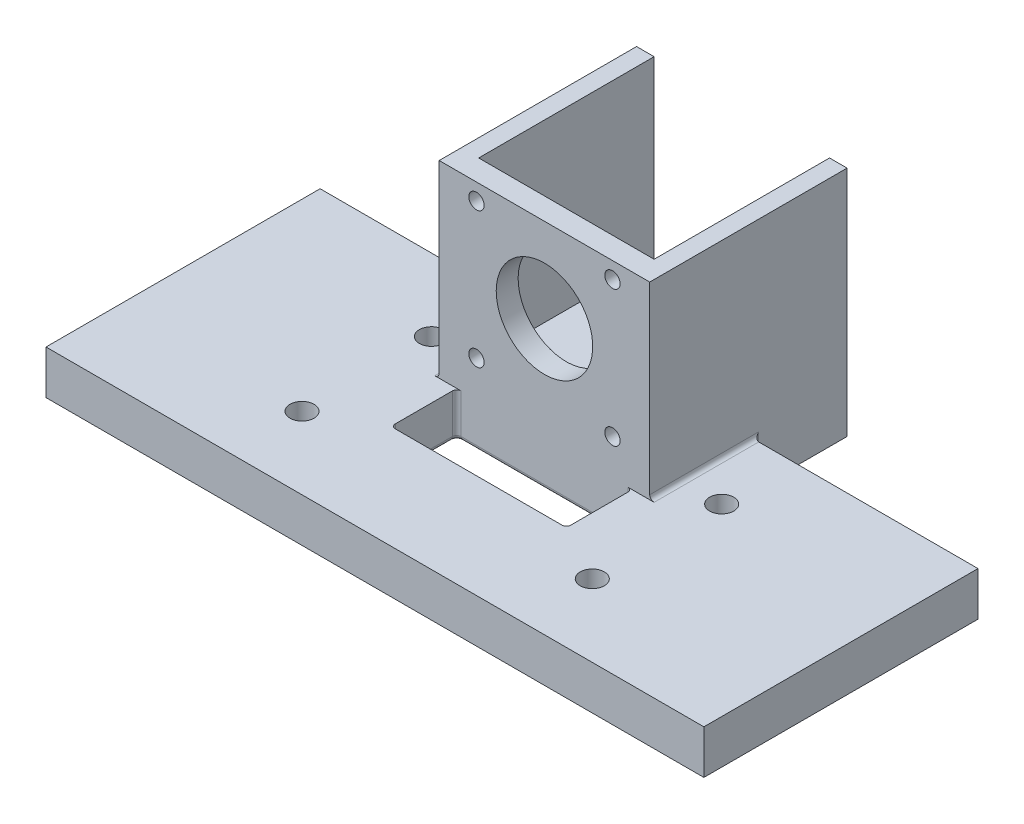
from build123d import *

# Parameters (mm, degrees)
SKETCH1_R            = 2.75
SKETCH1_W            = 40
SKETCH1_H            = 15
BOSS_EXTRUDE1_DEPTH  = 10
SKETCH3_W            = 40
SKETCH3_H            = 5
BOSS_EXTRUDE2_DEPTH  = 43
CUT_EXTRUDE1_REACH   = 166.968
SKETCH4_R            = 1.75
SKETCH4_R_2          = 11
SKETCH8_W            = 4
SKETCH8_H            = 45
BOSS_EXTRUDE4_DEPTH  = 43
SKETCH11_W           = 40
SKETCH11_H           = 40
BOSS_EXTRUDE15_DEPTH = 3
FILLET3_R            = 1
FILLET6_R            = 1
FILLET7_R            = 1


with BuildPart() as part:
    # Sketch1 → Boss-Extrude1 (new body)
    with BuildSketch(Plane(origin=(0, 0, 0), x_dir=(1, 0, 0), z_dir=(0, 1, 0))):
        Polygon((51, 62.5), (51, 83.65), (99, 83.65), (99, 62.5), (150, 62.5), (150, 0), (0, 0), (0, 62.5), align=None)
        with Locations(Location((108.05464, 46, 0), (0, 0, 270))):
            Circle(SKETCH1_R, mode=Mode.SUBTRACT)
        with Locations(Location((41.87366, 46, 0), (0, 0, 270))):
            Circle(SKETCH1_R, mode=Mode.SUBTRACT)
        with Locations(Location((41.87366, 16.5, 0), (0, 0, 270))):
            Circle(SKETCH1_R, mode=Mode.SUBTRACT)
        with Locations(Location((108.05464, 16.5, 0), (0, 0, 270))):
            Circle(SKETCH1_R, mode=Mode.SUBTRACT)
        with Locations((75, 31.15)):
            Rectangle(SKETCH1_W, SKETCH1_H, mode=Mode.SUBTRACT)
    extrude(amount=BOSS_EXTRUDE1_DEPTH)

    # Sketch3 → Boss-Extrude2 (add)
    with BuildSketch(Plane(origin=(0, 10, 0), x_dir=(1, 0, 0), z_dir=(0, 1, 0))):
        with Locations((75, 41.15)):
            Rectangle(SKETCH3_W, SKETCH3_H)
    extrude(amount=BOSS_EXTRUDE2_DEPTH)

    # Sketch4 → Cut-Extrude1 (cut, up to next)
    with BuildSketch(Plane(origin=(0, 0, -43.65), x_dir=(-1, 0, 0), z_dir=(0, 0, -1)), mode=Mode.PRIVATE) as cut_extrude1_sk1:
        with Locations((-59.5, 18.25)):
            Circle(SKETCH4_R)
    cut_extrude1_tool1 = extrude(cut_extrude1_sk1.sketch, amount=-CUT_EXTRUDE1_REACH, mode=Mode.PRIVATE) & part.part
    # Sketch4 → Cut-Extrude1 (cut, up to next)
    with BuildSketch(Plane(origin=(0, 0, -43.65), x_dir=(-1, 0, 0), z_dir=(0, 0, -1)), mode=Mode.PRIVATE) as cut_extrude1_sk2:
        with Locations((-90.5, 18.25)):
            Circle(SKETCH4_R)
    cut_extrude1_tool2 = extrude(cut_extrude1_sk2.sketch, amount=-CUT_EXTRUDE1_REACH, mode=Mode.PRIVATE) & part.part
    # Sketch4 → Cut-Extrude1 (cut, up to next)
    with BuildSketch(Plane(origin=(0, 0, -43.65), x_dir=(-1, 0, 0), z_dir=(0, 0, -1)), mode=Mode.PRIVATE) as cut_extrude1_sk3:
        with Locations((-75, 33.75)):
            Circle(SKETCH4_R_2)
    cut_extrude1_tool3 = extrude(cut_extrude1_sk3.sketch, amount=-CUT_EXTRUDE1_REACH, mode=Mode.PRIVATE) & part.part
    # Sketch4 → Cut-Extrude1 (cut, up to next)
    with BuildSketch(Plane(origin=(0, 0, -43.65), x_dir=(-1, 0, 0), z_dir=(0, 0, -1)), mode=Mode.PRIVATE) as cut_extrude1_sk4:
        with Locations((-90.5, 49.25)):
            Circle(SKETCH4_R)
    cut_extrude1_tool4 = extrude(cut_extrude1_sk4.sketch, amount=-CUT_EXTRUDE1_REACH, mode=Mode.PRIVATE) & part.part
    # Sketch4 → Cut-Extrude1 (cut, up to next)
    with BuildSketch(Plane(origin=(0, 0, -43.65), x_dir=(-1, 0, 0), z_dir=(0, 0, -1)), mode=Mode.PRIVATE) as cut_extrude1_sk5:
        with Locations((-59.5, 49.25)):
            Circle(SKETCH4_R)
    cut_extrude1_tool5 = extrude(cut_extrude1_sk5.sketch, amount=-CUT_EXTRUDE1_REACH, mode=Mode.PRIVATE) & part.part
    add(cut_extrude1_tool1.solids().sort_by_distance((59.5, 18.25, -43.65))[0], mode=Mode.SUBTRACT)
    add(cut_extrude1_tool2.solids().sort_by_distance((90.5, 18.25, -43.65))[0], mode=Mode.SUBTRACT)
    add(cut_extrude1_tool3.solids().sort_by_distance((75, 33.75, -43.65))[0], mode=Mode.SUBTRACT)
    add(cut_extrude1_tool4.solids().sort_by_distance((90.5, 49.25, -43.65))[0], mode=Mode.SUBTRACT)
    add(cut_extrude1_tool5.solids().sort_by_distance((59.5, 49.25, -43.65))[0], mode=Mode.SUBTRACT)

    # Sketch8 → Boss-Extrude4 (add)
    with BuildSketch(Plane(origin=(0, 10, 0), x_dir=(1, 0, 0), z_dir=(0, 1, 0))):
        with Locations((53, 61.15)):
            Rectangle(SKETCH8_W, SKETCH8_H)
        with Locations((97, 61.15)):
            Rectangle(SKETCH8_W, SKETCH8_H)
    extrude(amount=BOSS_EXTRUDE4_DEPTH)

    # Sketch11 → Boss-Extrude15 (add)
    with BuildSketch(Plane(origin=(0, 10, 0), x_dir=(1, 0, 0), z_dir=(0, 1, 0))):
        with Locations((75, 63.65)):
            Rectangle(SKETCH11_W, SKETCH11_H)
    extrude(amount=BOSS_EXTRUDE15_DEPTH)

    # Fillet3
    fillet3_edges = [part.edges().sort_by_distance(p)[0] for p in [
        (55, 0, -31.15),
        (75, 0, -23.65),
        (95, 0, -31.15),
        (75, 0, -38.65),
        (55, 5, -38.65),
        (55, 5, -23.65),
        (95, 5, -23.65),
        (95, 5, -38.65),
    ]]
    fillet(fillet3_edges, radius=FILLET3_R)

    # Fillet6
    fillet6_edges = [part.edges().sort_by_distance(p)[0] for p in [
        (99, 10, -50.575),
        (51, 10, -50.575),
    ]]
    fillet(fillet6_edges, radius=FILLET6_R)

    # Fillet7
    fillet7_edges = [part.edges().sort_by_distance(p)[0] for p in [
        (99, 5.5, -62.5),
        (51, 5.5, -62.5),
    ]]
    fillet(fillet7_edges, radius=FILLET7_R)


solid = part.part
